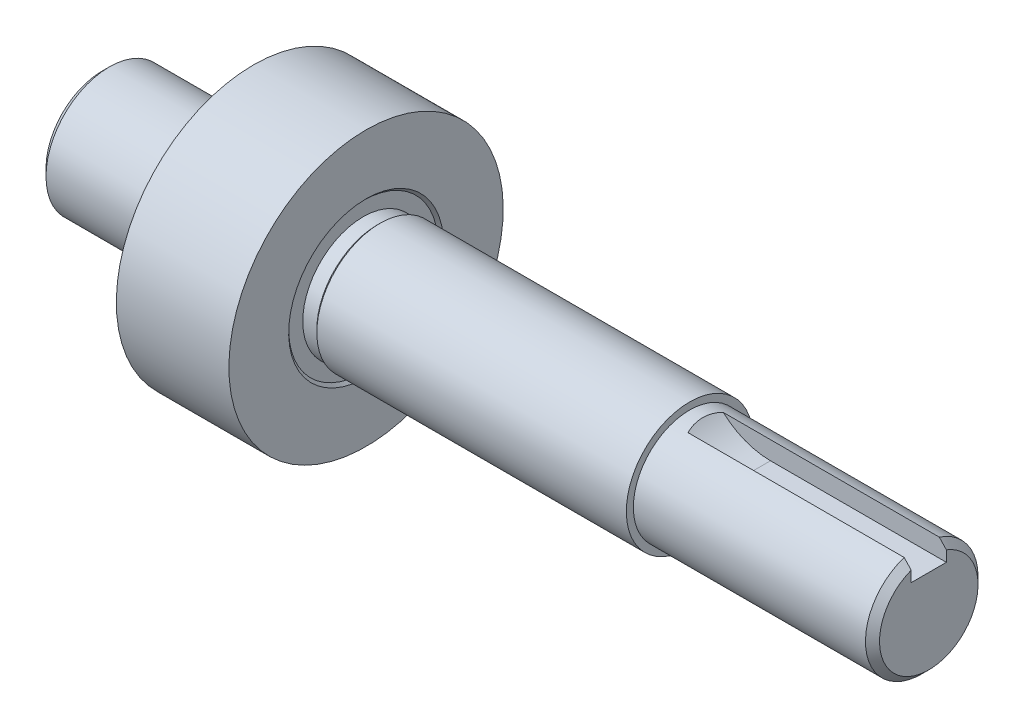
from build123d import *

# Parameters (mm, degrees)
CHAMFER_1_SIZE      = 1
CUT_EXTRUDE_1_DEPTH = 2.5
CHAMFER_2_SIZE      = 1


with BuildPart() as part:
    # 草图1 → 旋转1 (revolve)
    with BuildSketch(Plane.XY):
        Polygon((-58.75, 0), (-58.75, 9), (-39.25, 9), (-38.85, 8.6), (-36.85, 8.6), (-36.85, 10.6), (-37.25, 11), (-37.25, 19.5), (-21.25, 19.5), (-21.25, 11), (-21.65, 10.6), (-21.65, 8.6), (-19.65, 8.6), (-19.25, 9), (24.75, 9), (24.75, 8), (58.75, 8), (58.75, 0), align=None)
    revolve(axis=Axis((58.75, 0, 0), (-1, 0, 0)))

    # 倒角1
    chamfer_1_edges = [part.edges().sort_by_distance(p)[0] for p in [
        (-58.75, -9, 0),
    ]]
    chamfer(chamfer_1_edges, length=CHAMFER_1_SIZE)

    # 草图3 → 切除-拉伸1 (cut, symmetric)
    with BuildSketch(Plane.XY):
        with BuildLine():
            Line((58.75, 5), (33.75, 5))
            ThreePointArc((33.75, 5), (29.877016654, 5.780455543), (26.608571571, 8))
            Line((26.608571571, 8), (26.608571571, 13))
            Line((26.608571571, 13), (58.75, 13))
            Line((58.75, 13), (58.75, 5))
        make_face()
    extrude(amount=CUT_EXTRUDE_1_DEPTH, both=True, mode=Mode.SUBTRACT)

    # 倒角2
    chamfer_2_edges = [part.edges().sort_by_distance(p)[0] for p in [
        (58.75, -8, 0),
    ]]
    chamfer(chamfer_2_edges, length=CHAMFER_2_SIZE)


solid = part.part
